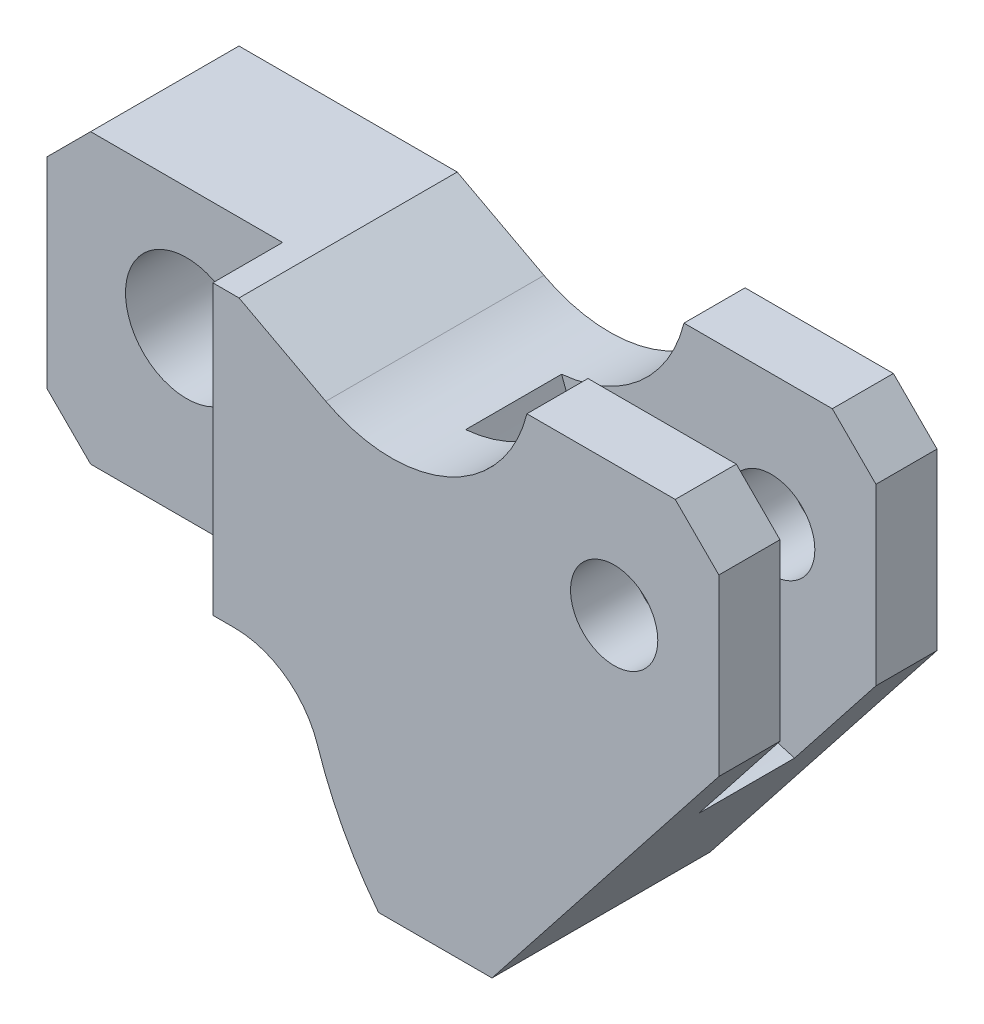
from build123d import *

# Parameters (mm, degrees)
SKETCH1_R           = 5
SKETCH1_R_2         = 7
BOSS_EXTRUDE1_DEPTH = 12.5
CUT_EXTRUDE1_START  = 4.5
SKETCH1_3_W         = 27
SKETCH1_3_H         = 33
SKETCH1_3_R         = 7
CUT_EXTRUDE1_DEPTH  = 8
CHAMFER1_SIZE       = 5
CUT_EXTRUDE2_DEPTH  = 5.5


with BuildPart() as part:
    # Sketch1 → Boss-Extrude1 (new, symmetric)
    with BuildSketch(Plane.XY):
        with BuildLine():
            Line((37.532366207, -3.84), (15.532366207, -3.84))
            ThreePointArc((15.532366207, -3.84), (6.522255442, -14.610276655), (-7.511545005, -14.127161486))
            Line((-7.511545005, -14.127161486), (-17.455249537, -8.84))
            Line((-17.455249537, -8.84), (-47.467633793, -8.84))
            Line((-47.467633793, -8.84), (-47.467633793, -41.84))
            Line((-47.467633793, -41.84), (-17.965724565, -41.84))
            ThreePointArc((-17.965724565, -41.84), (-12.096906214, -43.743274047), (-8.462081793, -48.728605767))
            ThreePointArc((-8.462081793, -48.728605767), (-5.535546312, -55.58874428), (-1.467633793, -61.84))
            Line((-1.467633793, -61.84), (11.532366207, -61.84))
            Line((11.532366207, -61.84), (37.532366207, -28.84))
            Line((37.532366207, -28.84), (37.532366207, -3.84))
        make_face()
        with Locations((25.532366207, -18.84)):
            Circle(SKETCH1_R, mode=Mode.SUBTRACT)
        with Locations((-31.467633793, -22.84)):
            Circle(SKETCH1_R_2, mode=Mode.SUBTRACT)
    extrude(amount=BOSS_EXTRUDE1_DEPTH, both=True)

    # Sketch1<3> → Cut-Extrude1 (cut)
    with BuildSketch(Plane.XY.offset(CUT_EXTRUDE1_START)):
        with Locations((-33.967633793, -25.34)):
            Rectangle(SKETCH1_3_W, SKETCH1_3_H)
        with Locations((-31.467633793, -22.84)):
            Circle(SKETCH1_3_R, mode=Mode.SUBTRACT)
    extrude(amount=CUT_EXTRUDE1_DEPTH, mode=Mode.SUBTRACT)

    # Chamfer1
    chamfer1_edges = [part.edges().sort_by_distance(p)[0] for p in [
        (37.532366207, -3.84, 0),
        (-47.467633793, -41.84, -4),
        (-47.467633793, -8.84, -4),
    ]]
    chamfer(chamfer1_edges, length=CHAMFER1_SIZE)

    # Sketch4 → Cut-Extrude2 (cut, symmetric)
    with BuildSketch(Plane.XY):
        with BuildLine():
            Line((37.532366207, -8.84), (37.532366207, -28.84))
            Line((37.532366207, -28.84), (28.205719919, -40.677666444))
            ThreePointArc((28.205719919, -40.677666444), (11.699513519, -31.708687123), (1.506567213, -15.928912557))
            ThreePointArc((1.506567213, -15.928912557), (10.445897028, -12.1195394), (15.532366207, -3.84))
            Line((15.532366207, -3.84), (32.532366207, -3.84))
            Line((32.532366207, -3.84), (37.532366207, -8.84))
        make_face()
    extrude(amount=CUT_EXTRUDE2_DEPTH, both=True, mode=Mode.SUBTRACT)


solid = part.part
